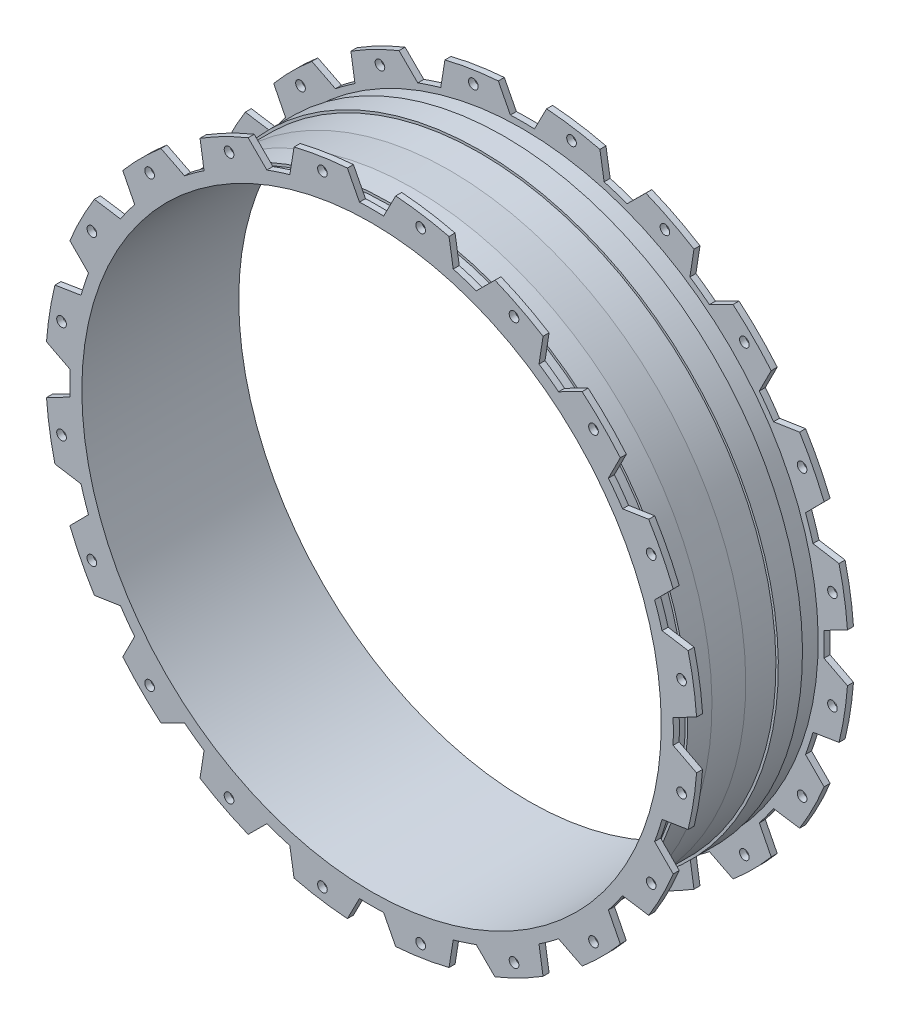
from build123d import *

# Parameters (mm, degrees)
CUT_EXTRUDE1_DEPTH = 404.360880602
CIRPATTERN1_COUNT  = 20
SKETCH3_R          = 4
CUT_EXTRUDE2_DEPTH = 403.367990775
CIRPATTERN2_COUNT  = 20


with BuildPart() as part:
    # Sketch1 → Revolve1 (revolve)
    with BuildSketch(Plane(origin=(0, 0, 0), x_dir=(0, 0, -1), z_dir=(1, 0, 0))):
        Polygon((65, 240), (65, 270), (60, 270), (60, 245), (45, 245), (45, 247), (25, 247), (25, 245), (0, 245), (-30, 247), (-50, 247), (-50, 245), (-60, 245), (-60, 270), (-65, 270), (-65, 240), align=None)
    revolve(axis=Axis((0, 0, -155.812635439), (0, 0, 1)))

    # Sketch2 → Cut-Extrude1 (cut, through all)
    with BuildSketch(Plane.XY.offset(65)):
        with BuildLine():
            Line((0, 250), (0, 270))
            ThreePointArc((0, 270), (-10.006875229, 269.814496364), (-20, 269.258240357))
            Line((-20, 269.258240357), (-10, 249.799919936))
            ThreePointArc((-10, 249.799919936), (-5.001000701, 249.949974979), (0, 250))
        make_face()
        with BuildLine():
            ThreePointArc((20, 269.258240357), (10.006875229, 269.814496364), (0, 270))
            Line((0, 270), (0, 250))
            ThreePointArc((0, 250), (5.001000701, 249.949974979), (10, 249.799919936))
            Line((10, 249.799919936), (20, 269.258240357))
        make_face()
    cut_extrude1 = extrude(amount=-CUT_EXTRUDE1_DEPTH, mode=Mode.SUBTRACT)

    # CirPattern1: Cut-Extrude1 ×20 about axis
    cirpattern1_axis = Axis((0, 0, 0), (0, 0, 1))
    for i in range(1, CIRPATTERN1_COUNT):
        add(cut_extrude1.rotate(cirpattern1_axis, i * 360 / CIRPATTERN1_COUNT), mode=Mode.SUBTRACT)

    # Sketch3 → Cut-Extrude2 (cut, through all)
    with BuildSketch(Plane.XY.offset(65)):
        with Locations((40.67296091, 256.798968555)):
            Circle(SKETCH3_R)
    cut_extrude2 = extrude(amount=-CUT_EXTRUDE2_DEPTH, mode=Mode.SUBTRACT)

    # CirPattern2: Cut-Extrude2 ×20 about axis
    cirpattern2_axis = Axis((0, 0, 0), (0, 0, 1))
    for i in range(1, CIRPATTERN2_COUNT):
        add(cut_extrude2.rotate(cirpattern2_axis, i * 360 / CIRPATTERN2_COUNT), mode=Mode.SUBTRACT)


solid = part.part
